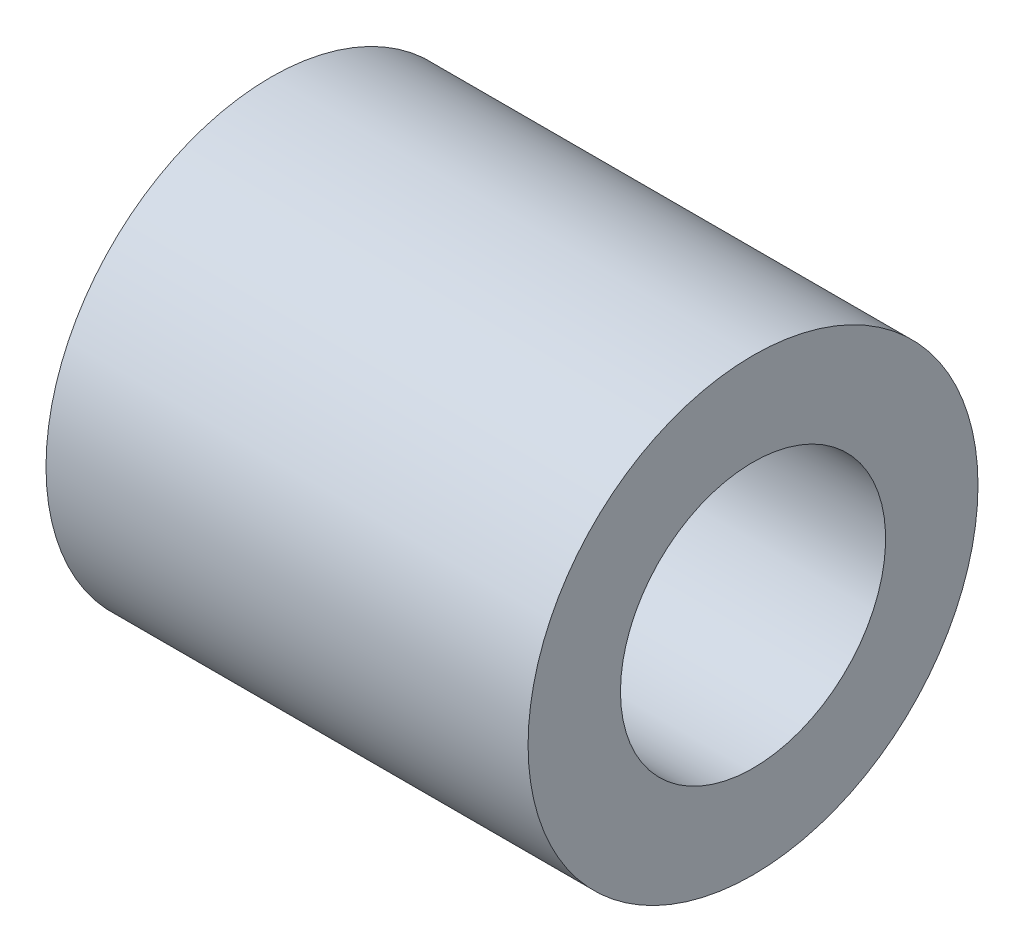
from build123d import *

# Parameters (mm, degrees)
INSERT_M4_SKETCH_W = 6
INSERT_M4_SKETCH_H = 1.15


with BuildPart() as part:
    # Insert_M4 Sketch → Insert_M4 (revolve)
    with BuildSketch(Plane.XY):
        with Locations((3, 2.225)):
            Rectangle(INSERT_M4_SKETCH_W, INSERT_M4_SKETCH_H)
    revolve(axis=Axis((-400, 0, 0), (1, 0, 0)))


solid = part.part
